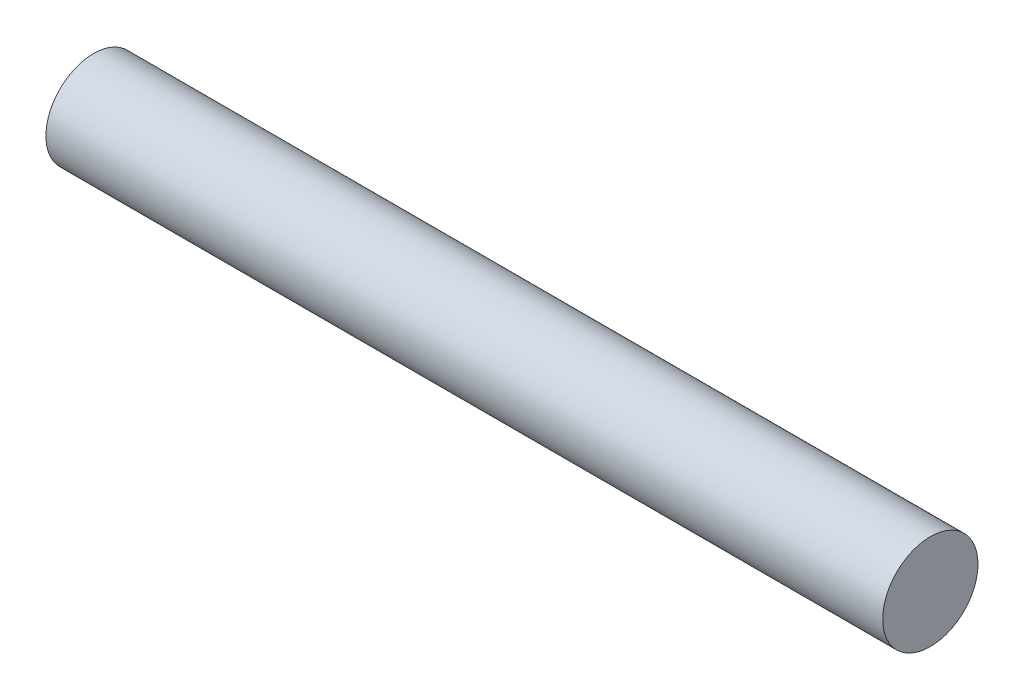
from build123d import *

# Parameters (mm, degrees)
SKETCH1_R           = 5
BOSS_EXTRUDE1_DEPTH = 87.8


with BuildPart() as part:
    # Sketch1 → Boss-Extrude1 (new body)
    with BuildSketch(Plane(origin=(0, 0, 0), x_dir=(0, 0, -1), z_dir=(1, 0, 0))):
        Circle(SKETCH1_R)
    extrude(amount=BOSS_EXTRUDE1_DEPTH)


solid = part.part
